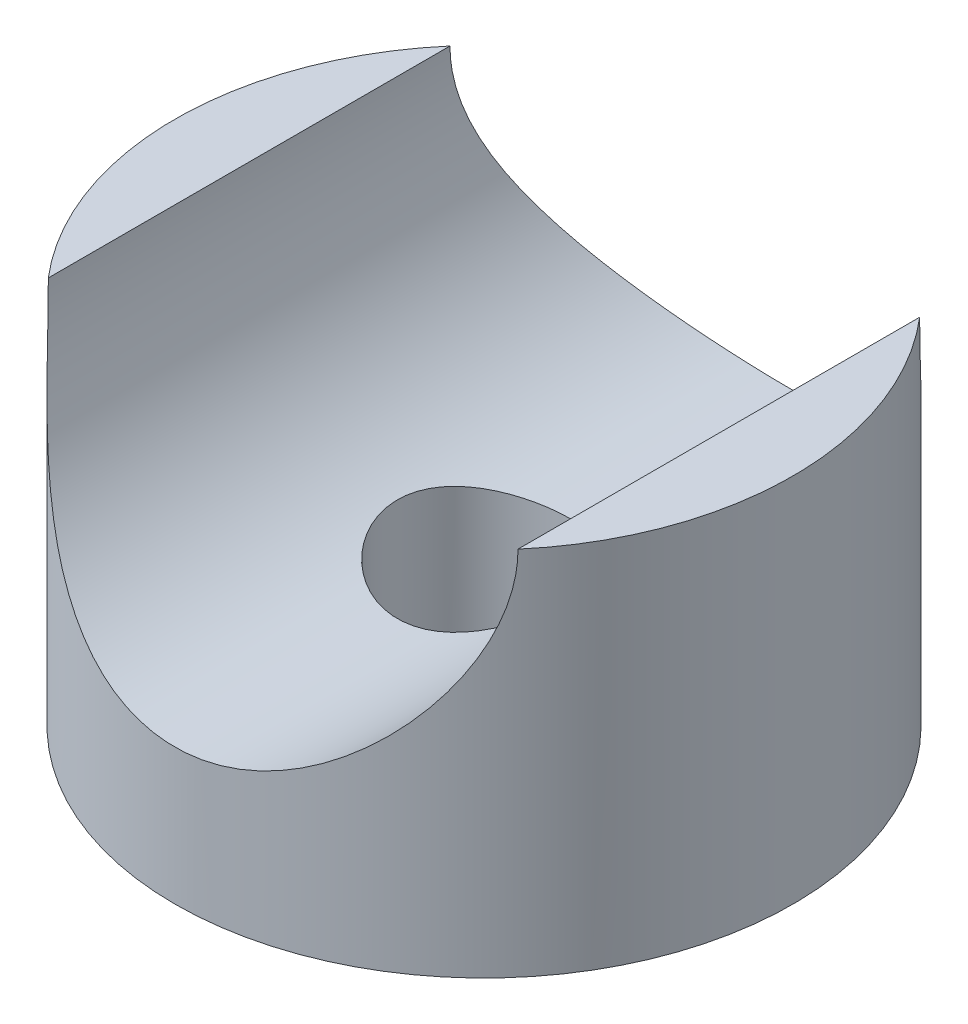
from build123d import *

# Parameters (mm, degrees)
SKETCH1_R               = 12.5
SKETCH1_R_2             = 3.5
BOSS_EXTRUDE1_DEPTH     = 15
CUT_EXTRUDE1_DEPTH      = 22
CUT_EXTRUDE1_DEPTH_BACK = 22
SKETCH2_R               = 9.5


with BuildPart() as part:
    # Sketch1 → Boss-Extrude1 (new body)
    with BuildSketch(Plane(origin=(0, 0, 0), x_dir=(1, 0, 0), z_dir=(0, 1, 0))):
        Circle(SKETCH1_R)
        Circle(SKETCH1_R_2, mode=Mode.SUBTRACT)
    extrude(amount=BOSS_EXTRUDE1_DEPTH)

    # Sketch2 → Cut-Extrude1 (cut, two sides: drawn at the far end of the back side and taken through both)
    with BuildSketch(Plane.XY.offset(-CUT_EXTRUDE1_DEPTH_BACK)):
        with Locations((0, 15)):
            Circle(SKETCH2_R)
    extrude(amount=CUT_EXTRUDE1_DEPTH + CUT_EXTRUDE1_DEPTH_BACK, mode=Mode.SUBTRACT)


solid = part.part
